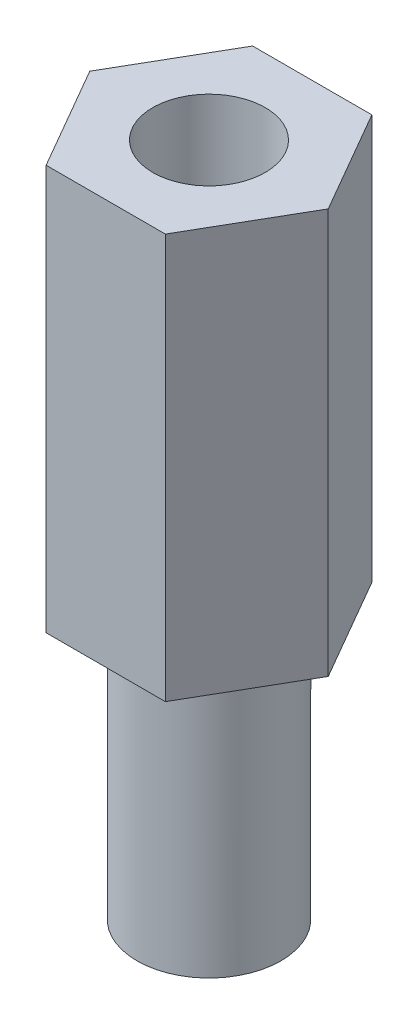
from build123d import *

# Parameters (mm, degrees)
EXTRUDE_1_DEPTH     = 9
SKETCH_6_R          = 1.6
EXTRUDE_2_DEPTH     = 6
SKETCH_7_R          = 1.25
CUT_EXTRUDE_1_DEPTH = 5


with BuildPart() as part:
    # 草图4 → 凸台-拉伸1 (new body)
    with BuildSketch(Plane(origin=(0, 0, 0), x_dir=(1, 0, 0), z_dir=(0, 1, 0))):
        Polygon((1.325, -2.29496732), (2.65, 0), (1.325, 2.29496732), (-1.325, 2.29496732), (-2.65, 0), (-1.325, -2.29496732), align=None)
    extrude(amount=EXTRUDE_1_DEPTH)

    # 草图6 → 凸台-拉伸2 (add)
    with BuildSketch(Plane(origin=(0, 0, 0), x_dir=(-1, 0, 0), z_dir=(0, -1, 0))):
        with Locations(Location((0, 0, 0), (0, 0, 270))):
            Circle(SKETCH_6_R)
    extrude(amount=EXTRUDE_2_DEPTH)

    # 草图7 → 切除-拉伸1 (cut)
    with BuildSketch(Plane(origin=(0, 9, 0), x_dir=(1, 0, 0), z_dir=(0, 1, 0))):
        with Locations(Location((0, 0, 0), (0, 0, 270))):
            Circle(SKETCH_7_R)
    extrude(amount=-CUT_EXTRUDE_1_DEPTH, mode=Mode.SUBTRACT)


solid = part.part
